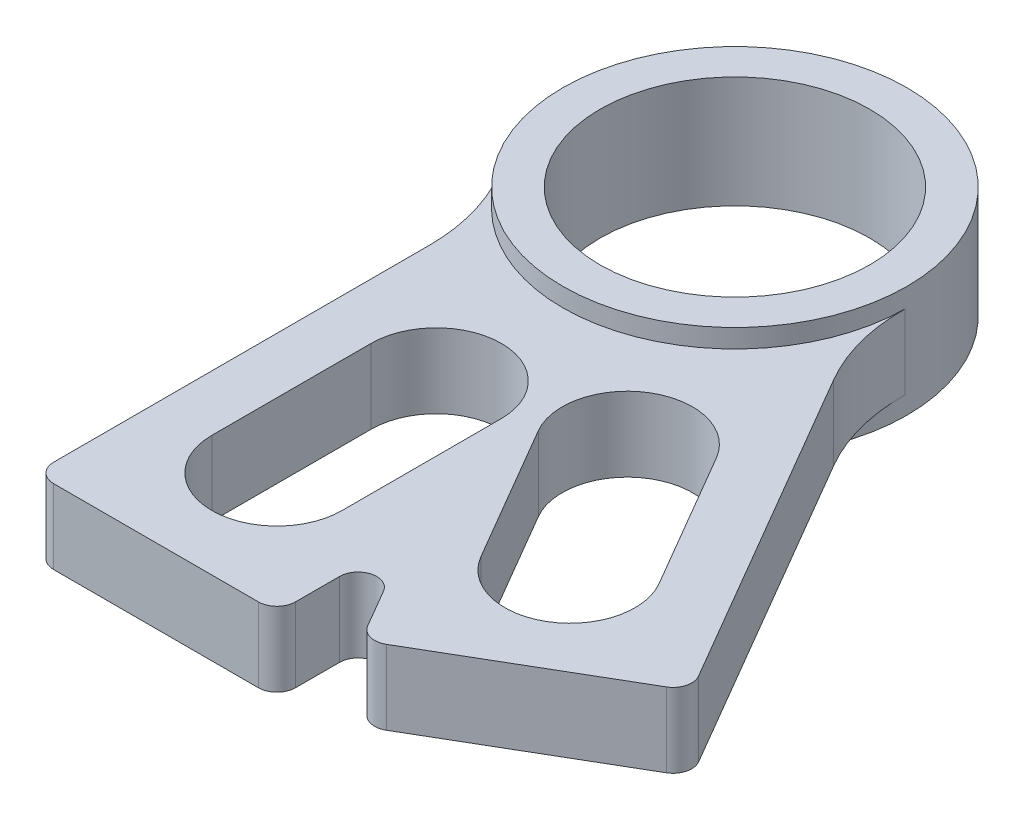
from build123d import *

# Parameters (mm, degrees)
SKETCH1_R                      = 14.6812
SKETCH1_R_2                    = 11.5062
BEARING_INSERT_EXTRUDE_DEPTH   = 4.7625
APEX_SLOT_INSERT_EXTRUDE_DEPTH = 3.175
FILLET1_R                      = 16.002
FILLET2_R                      = 1.5875


with BuildPart() as part:
    # Sketch1 → Bearing_Insert_Extrude (new, symmetric)
    with BuildSketch(Plane(origin=(0, 0, 0), x_dir=(1, 0, 0), z_dir=(0, 1, 0))):
        with Locations(Location((0, 0, 0), (0, 0, 90))):
            Circle(SKETCH1_R)
        with Locations(Location((0, 0, 0), (0, 0, 90))):
            Circle(SKETCH1_R_2, mode=Mode.SUBTRACT)
    extrude(amount=BEARING_INSERT_EXTRUDE_DEPTH, both=True)

    # Sketch1<4> → Apex_Slot_Insert_Extrude (add, symmetric)
    with BuildSketch(Plane(origin=(0, 0, 0), x_dir=(1, 0, 0), z_dir=(0, 1, 0))):
        with BuildLine():
            Line((-10.31875, -10.443228997), (-10.31875, -49.3903))
            Line((-10.31875, -49.3903), (10.31875, -49.3903))
            Line((10.31875, -49.3903), (10.31875, -38.179375))
            Line((10.31875, -38.179375), (15.966186692, -47.863965759))
            Line((15.966186692, -47.863965759), (33.793952178, -37.46794806))
            Line((33.793952178, -37.46794806), (14.174597146, -3.823405444))
            ThreePointArc((14.174597146, -3.823405444), (3.83045758, -14.172693046), (-10.31875, -10.443228997))
        make_face()
        with BuildLine():
            ThreePointArc((5.55625, -39.07155), (0, -44.6278), (-5.55625, -39.07155))
            Line((-5.55625, -39.07155), (-5.55625, -25.48255))
            ThreePointArc((-5.55625, -25.48255), (0, -19.9263), (5.55625, -25.48255))
            Line((5.55625, -25.48255), (5.55625, -39.07155))
        make_face(mode=Mode.SUBTRACT)
        with BuildLine():
            ThreePointArc((24.481843601, -30.953146324), (22.480988428, -38.551857182), (14.88227757, -36.551002008))
            Line((14.88227757, -36.551002008), (8.036899762, -24.812104118))
            ThreePointArc((8.036899762, -24.812104118), (10.037754935, -17.213393261), (17.636465793, -19.214248434))
            Line((17.636465793, -19.214248434), (24.481843601, -30.953146324))
        make_face(mode=Mode.SUBTRACT)
    extrude(amount=APEX_SLOT_INSERT_EXTRUDE_DEPTH, both=True)

    # Fillet1
    fillet1_edges = [part.edges().sort_by_distance(p)[0] for p in [
        (14.174597146, 0, 3.823405444),
        (-10.31875, 0, 10.443228997),
    ]]
    fillet(fillet1_edges, radius=FILLET1_R)

    # Fillet2
    fillet2_edges = [part.edges().sort_by_distance(p)[0] for p in [
        (-10.31875, 0, 49.3903),
        (10.31875, 0, 49.3903),
        (10.31875, 0, 38.179375),
        (15.966186692, 0, 47.863965759),
        (33.793952178, 0, 37.46794806),
    ]]
    fillet(fillet2_edges, radius=FILLET2_R)


solid = part.part
